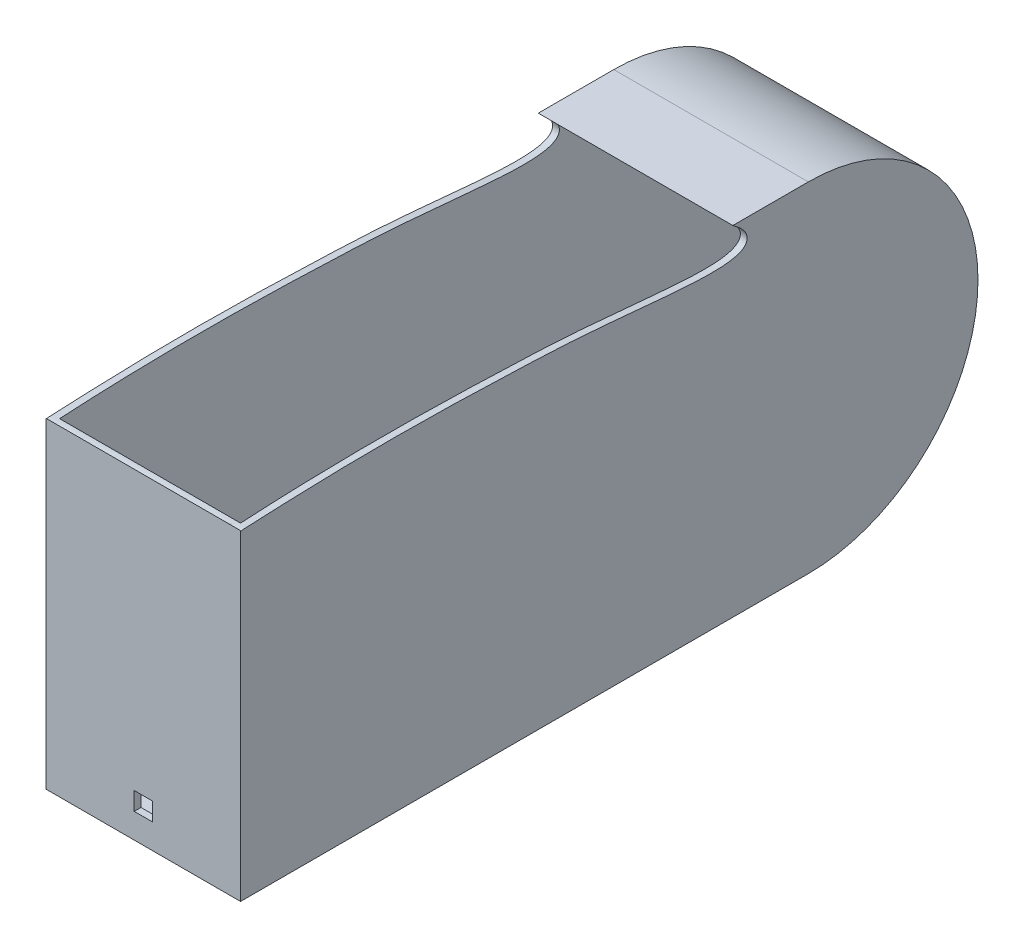
from build123d import *

# Parameters (mm, degrees)
BOSS_EXTRUDE1_DEPTH            = 63.5
BOSS_EXTRUDE1_DEPTH_BACK       = 63.5
CUT_EXTRUDE1_REACH             = 573.246
SKETCH4_W                      = 12.7
SKETCH4_H                      = 12.7
BOSS_EXTRUDE3_DEPTH            = 4.7625
CUT_EXTRUDE2_REACH             = 468.787
CUT_EXTRUDE2_DIRECTION_2_REACH = 468.787
CUT_EXTRUDE3_DEPTH             = 136.525


with BuildPart() as part:
    # Sketch2 → Boss-Extrude1 (new, two sides: drawn at the far end of the back side and taken through both)
    with BuildSketch(Plane(origin=(0, 0, 0), x_dir=(0, 0, -1), z_dir=(1, 0, 0)).offset(-BOSS_EXTRUDE1_DEPTH_BACK)):
        with BuildLine():
            Line((0, -4.7625), (-398.4625, -4.7625))
            Line((-398.4625, -4.7625), (-398.4625, 233.3625))
            Line((-398.4625, 233.3625), (0, 233.3625))
            ThreePointArc((0, 233.3625), (119.0625, 114.3), (0, -4.7625))
        make_face()
        with BuildLine():
            Line((0, 0), (-393.7, 0))
            Line((-393.7, 0), (-393.7, 228.6))
            Line((-393.7, 228.6), (0, 228.6))
            ThreePointArc((0, 228.6), (114.3, 114.3), (0, 0))
        make_face(mode=Mode.SUBTRACT)
    extrude(amount=BOSS_EXTRUDE1_DEPTH + BOSS_EXTRUDE1_DEPTH_BACK)

    # Sketch4 → Cut-Extrude1 (cut, up to next)
    with BuildSketch(Plane.XY.offset(398.4625), mode=Mode.PRIVATE) as cut_extrude1_sk1:
        with Locations((0, 19.05)):
            Rectangle(SKETCH4_W, SKETCH4_H)
    cut_extrude1_tool1 = extrude(cut_extrude1_sk1.sketch, amount=-CUT_EXTRUDE1_REACH, mode=Mode.PRIVATE) & part.part
    add(cut_extrude1_tool1.solids().sort_by_distance((0, 19.05, 398.4625))[0], mode=Mode.SUBTRACT)

    # Sketch9 → Boss-Extrude3 (add)
    with BuildSketch(Plane(origin=(63.5, 0, 0), x_dir=(0, 0, -1), z_dir=(1, 0, 0))):
        with BuildLine():
            Line((-398.4625, 233.3625), (0, 233.3625))
            ThreePointArc((0, 233.3625), (119.0625, 114.3), (0, -4.7625))
            Line((0, -4.7625), (-398.4625, -4.7625))
            Line((-398.4625, -4.7625), (-398.4625, 233.3625))
        make_face()
    boss_extrude3 = extrude(amount=BOSS_EXTRUDE3_DEPTH)

    # Mirror1: Boss-Extrude3 across plane
    add(boss_extrude3.mirror(Plane(origin=(0, 0, 0), x_dir=(0, 0, 1), z_dir=(1, 0, 0))))

    # Sketch11 → Cut-Extrude2 (cut, up to next)
    with BuildSketch(Plane(origin=(0, 0, 0), x_dir=(0, 0, -1), z_dir=(1, 0, 0)), mode=Mode.PRIVATE) as cut_extrude2_sk1:
        with BuildLine():
            Line((-398.4625, 220.6625), (-398.549393223, 221.103452286))
            add(Edge.make_bspline(
                [(-398.549393223, 221.103452286), (-398.232700595, 221.211009466), (-396.970901441, 221.63954978), (-394.14642109, 222.600485882), (-389.462953517, 224.150302439), (-382.969998464, 226.259749178), (-374.723245355, 228.841368447), (-364.80000481, 231.813872481), (-353.297978696, 235.083165457), (-340.328032508, 238.545255758), (-326.021148985, 242.094575026), (-310.521429797, 245.617549826), (-293.994927933, 249.024771645), (-276.614504443, 252.20432036), (-258.567862768, 255.061254061), (-240.053343741, 257.520201331), (-221.279209389, 259.500514547), (-202.447059388, 260.937616248), (-183.64181928, 261.853164618), (-165.066079575, 261.889242872), (-146.980070346, 260.902418125), (-129.758757053, 258.98503391), (-113.629585221, 256.246806811), (-98.804456806, 252.805079969), (-85.468656161, 248.825528286), (-73.777495343, 244.484590441), (-63.856217252, 239.956374948), (-55.798201624, 235.414103694), (-49.638608789, 231.017198213), (-45.410140529, 226.860803831), (-42.982866367, 222.931348779), (-42.778551081, 218.986296857), (-45.130374502, 215.836723639), (-49.23769494, 213.876038864), (-54.878489437, 212.601675942), (-62.141431937, 211.952589942), (-70.954497433, 211.854882503), (-81.233579013, 212.250908039), (-92.863351661, 213.05360896), (-105.724740235, 214.17353372), (-119.693166749, 215.488554617), (-134.64317648, 216.89092489), (-150.445709996, 218.26416395), (-166.970044114, 219.486485379), (-184.211284992, 220.428545699), (-202.015771527, 221.118607839), (-220.195805294, 221.829251021), (-238.435682057, 222.413221363), (-256.531925379, 222.857510837), (-274.291608724, 223.140033413), (-291.519175726, 223.252027693), (-308.022545069, 223.203320199), (-323.615565221, 223.020606612), (-338.118364345, 222.71075189), (-351.360747498, 222.338100855), (-363.191371257, 221.908988988), (-373.444754133, 221.495841487), (-382.066215664, 221.0476688), (-388.753640958, 220.841691742), (-393.905599593, 220.266487962), (-396.455855294, 220.648579963), (-398.422990842, 219.934638372), (-398.453149809, 220.490245125), (-398.4625, 220.6625)],
                knots=[0, 0, 0, 0, 0.001371577, 0.005464776, 0.012234802, 0.021601969, 0.033461345, 0.04767125, 0.064081318, 0.082496261, 0.102719149, 0.124527079, 0.147675648, 0.171912573, 0.19697838, 0.222596912, 0.248496767, 0.274385101, 0.300041178, 0.325689988, 0.350525088, 0.374279703, 0.396711254, 0.417576734, 0.436654006, 0.45374439, 0.468679994, 0.481329415, 0.491630702, 0.499615789, 0.505546281, 0.510184984, 0.514824194, 0.520701508, 0.52851604, 0.538465752, 0.550542609, 0.564643256, 0.580638139, 0.598344876, 0.617584458, 0.638174401, 0.65992209, 0.682632113, 0.706120665, 0.730727383, 0.755700244, 0.780731769, 0.805564463, 0.829932396, 0.853570292, 0.876213105, 0.897609987, 0.917519394, 0.935698347, 0.951942678, 0.966047159, 0.97783994, 0.987174002, 0.993931501, 0.998018399, 0.999385644, 1, 1, 1, 1], degree=3))
        make_face()
    cut_extrude2_tool1 = extrude(cut_extrude2_sk1.sketch, amount=-CUT_EXTRUDE2_REACH, mode=Mode.PRIVATE) & part.part
    add(cut_extrude2_tool1.solids().sort_by_distance((0, 236.327035, 192.134804))[0], mode=Mode.SUBTRACT)

    # Sketch11 → Cut-Extrude2 direction 2 (cut, up to next)
    with BuildSketch(Plane(origin=(0, 0, 0), x_dir=(0, 0, -1), z_dir=(1, 0, 0)), mode=Mode.PRIVATE) as cut_extrude2_direction_2_sk1:
        with BuildLine():
            Line((-398.4625, 220.6625), (-398.549393223, 221.103452286))
            add(Edge.make_bspline(
                [(-398.549393223, 221.103452286), (-398.232700595, 221.211009466), (-396.970901441, 221.63954978), (-394.14642109, 222.600485882), (-389.462953517, 224.150302439), (-382.969998464, 226.259749178), (-374.723245355, 228.841368447), (-364.80000481, 231.813872481), (-353.297978696, 235.083165457), (-340.328032508, 238.545255758), (-326.021148985, 242.094575026), (-310.521429797, 245.617549826), (-293.994927933, 249.024771645), (-276.614504443, 252.20432036), (-258.567862768, 255.061254061), (-240.053343741, 257.520201331), (-221.279209389, 259.500514547), (-202.447059388, 260.937616248), (-183.64181928, 261.853164618), (-165.066079575, 261.889242872), (-146.980070346, 260.902418125), (-129.758757053, 258.98503391), (-113.629585221, 256.246806811), (-98.804456806, 252.805079969), (-85.468656161, 248.825528286), (-73.777495343, 244.484590441), (-63.856217252, 239.956374948), (-55.798201624, 235.414103694), (-49.638608789, 231.017198213), (-45.410140529, 226.860803831), (-42.982866367, 222.931348779), (-42.778551081, 218.986296857), (-45.130374502, 215.836723639), (-49.23769494, 213.876038864), (-54.878489437, 212.601675942), (-62.141431937, 211.952589942), (-70.954497433, 211.854882503), (-81.233579013, 212.250908039), (-92.863351661, 213.05360896), (-105.724740235, 214.17353372), (-119.693166749, 215.488554617), (-134.64317648, 216.89092489), (-150.445709996, 218.26416395), (-166.970044114, 219.486485379), (-184.211284992, 220.428545699), (-202.015771527, 221.118607839), (-220.195805294, 221.829251021), (-238.435682057, 222.413221363), (-256.531925379, 222.857510837), (-274.291608724, 223.140033413), (-291.519175726, 223.252027693), (-308.022545069, 223.203320199), (-323.615565221, 223.020606612), (-338.118364345, 222.71075189), (-351.360747498, 222.338100855), (-363.191371257, 221.908988988), (-373.444754133, 221.495841487), (-382.066215664, 221.0476688), (-388.753640958, 220.841691742), (-393.905599593, 220.266487962), (-396.455855294, 220.648579963), (-398.422990842, 219.934638372), (-398.453149809, 220.490245125), (-398.4625, 220.6625)],
                knots=[0, 0, 0, 0, 0.001371577, 0.005464776, 0.012234802, 0.021601969, 0.033461345, 0.04767125, 0.064081318, 0.082496261, 0.102719149, 0.124527079, 0.147675648, 0.171912573, 0.19697838, 0.222596912, 0.248496767, 0.274385101, 0.300041178, 0.325689988, 0.350525088, 0.374279703, 0.396711254, 0.417576734, 0.436654006, 0.45374439, 0.468679994, 0.481329415, 0.491630702, 0.499615789, 0.505546281, 0.510184984, 0.514824194, 0.520701508, 0.52851604, 0.538465752, 0.550542609, 0.564643256, 0.580638139, 0.598344876, 0.617584458, 0.638174401, 0.65992209, 0.682632113, 0.706120665, 0.730727383, 0.755700244, 0.780731769, 0.805564463, 0.829932396, 0.853570292, 0.876213105, 0.897609987, 0.917519394, 0.935698347, 0.951942678, 0.966047159, 0.97783994, 0.987174002, 0.993931501, 0.998018399, 0.999385644, 1, 1, 1, 1], degree=3))
        make_face()
    cut_extrude2_direction_2_tool1 = extrude(cut_extrude2_direction_2_sk1.sketch, amount=CUT_EXTRUDE2_DIRECTION_2_REACH, mode=Mode.PRIVATE) & part.part
    add(cut_extrude2_direction_2_tool1.solids().sort_by_distance((0, 236.327035, 192.134804))[0], mode=Mode.SUBTRACT)


with BuildPart() as cut_extrude2_piece_1:
    # of the separate pieces the step leaves, piece 1, a body of its own (cut_extrude2_pieces)
    add(part.part.solids().sort_by_distance((68.2625, 233.3625, 0))[0])


with BuildPart() as cut_extrude2_piece_2:
    # of the separate pieces the step leaves, piece 2, a body of its own (cut_extrude2_pieces)
    add(part.part.solids().sort_by_distance((68.2625, 233.3625, 359.323803316))[0])

    # Sketch12 → Cut-Extrude3 (cut)
    with BuildSketch(Plane.ZY.offset(68.2625)):
        with BuildLine():
            Line((398.4625, 221.132963555), (398.4625, 233.3625))
            Line((398.4625, 233.3625), (359.323803288, 233.362500008))
            add(Edge.make_bspline(
                [(359.323803288, 233.362500008), (361.320647135, 232.795545243), (366.644911042, 231.261231316), (374.723245355, 228.841368447), (382.969998464, 226.259749178), (389.462953517, 224.150302439), (394.14642109, 222.600485882), (396.941942115, 221.649402234), (398.174771889, 221.230683977), (398.4625, 221.132963555)],
                knots=[0.000125443, 0.000125443, 0.000125443, 0.000125443, 0.008637848, 0.022847753, 0.034707128, 0.044074296, 0.050844322, 0.054937521, 0.056183654, 0.056183654, 0.056183654, 0.056183654], degree=3))
        make_face()
    extrude(amount=-CUT_EXTRUDE3_DEPTH, mode=Mode.SUBTRACT)


solid = cut_extrude2_piece_1.part
